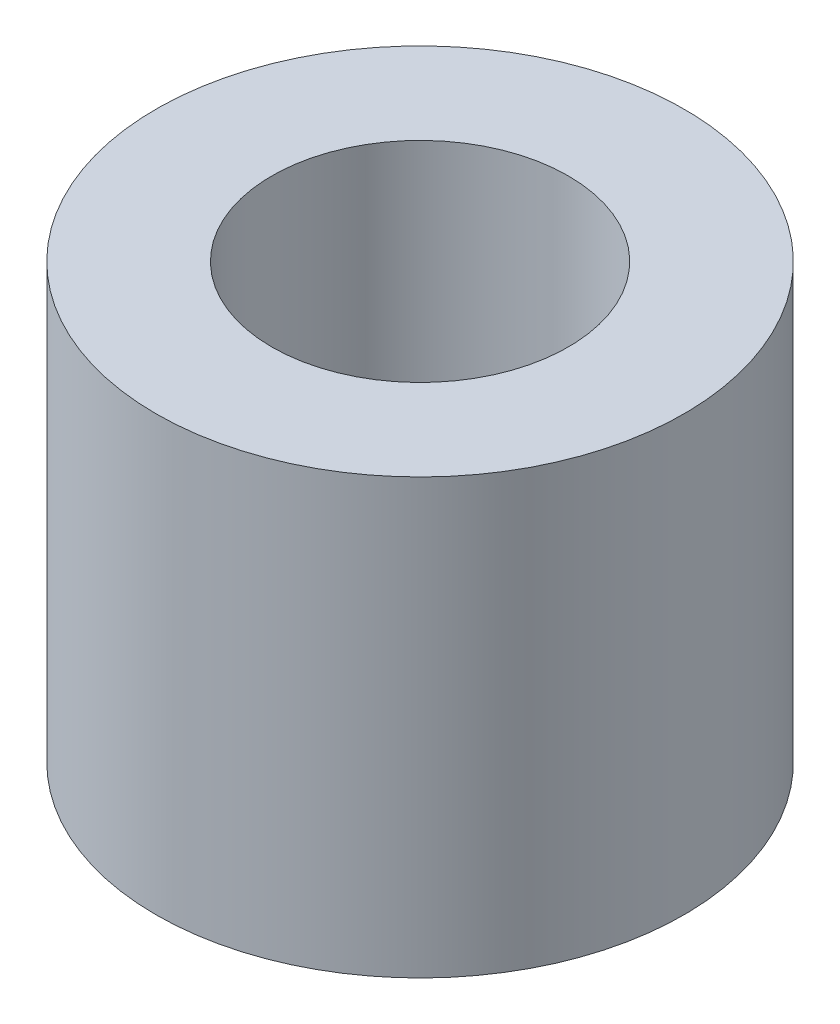
from build123d import *

# Parameters (mm, degrees)
SKETCH1_R           = 1.825
SKETCH1_R_2         = 1.025
BOSS_EXTRUDE1_DEPTH = 3


with BuildPart() as part:
    # Sketch1 → Boss-Extrude1 (new body)
    with BuildSketch(Plane(origin=(0, 0, 0), x_dir=(1, 0, 0), z_dir=(0, 1, 0))):
        with Locations(Location((0, 0, 0), (0, 0, 270))):
            Circle(SKETCH1_R)
        with Locations(Location((0, 0, 0), (0, 0, 270))):
            Circle(SKETCH1_R_2, mode=Mode.SUBTRACT)
    extrude(amount=BOSS_EXTRUDE1_DEPTH)


solid = part.part
